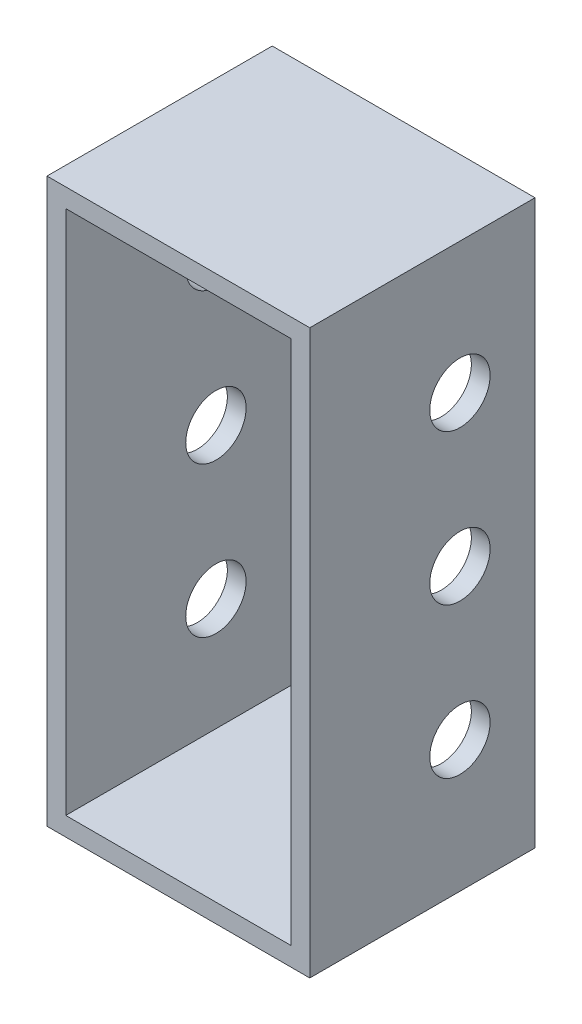
from build123d import *

# Parameters (mm, degrees)
SKETCH1_W           = 22.225
SKETCH1_H           = 19.05
BOSS_EXTRUDE1_DEPTH = 23.8125
SKETCH2_R           = 2.5527
CUT_EXTRUDE1_DEPTH  = 38.734444229
SHELL1_T            = -1.5875


with BuildPart() as part:
    # Sketch1 → Boss-Extrude1 (new, symmetric)
    with BuildSketch(Plane(origin=(0, 0, 0), x_dir=(1, 0, 0), z_dir=(0, 1, 0))):
        with Locations((11.1125, 9.525)):
            Rectangle(SKETCH1_W, SKETCH1_H)
    extrude(amount=BOSS_EXTRUDE1_DEPTH, both=True)

    # Sketch2 → Cut-Extrude1 (cut, through all)
    with BuildSketch(Plane.ZY):
        with Locations((-12.7, 12.7)):
            Circle(SKETCH2_R)
        with Locations((-12.7, -12.7)):
            Circle(SKETCH2_R)
        with Locations((-12.7, 0)):
            Circle(SKETCH2_R)
    extrude(amount=-CUT_EXTRUDE1_DEPTH, mode=Mode.SUBTRACT)

    # Shell1
    shell1_openings = [part.faces().sort_by_distance(p)[0] for p in [
        (11.1125, 12.7, -15.2527),
        (11.1125, -12.7, -15.2527),
        (11.1125, 0, -15.2527),
        (11.1125, 0, -19.05),
        (11.1125, 0, 0),
    ]]
    offset(amount=SHELL1_T, openings=shell1_openings, kind=Kind.INTERSECTION)


solid = part.part
